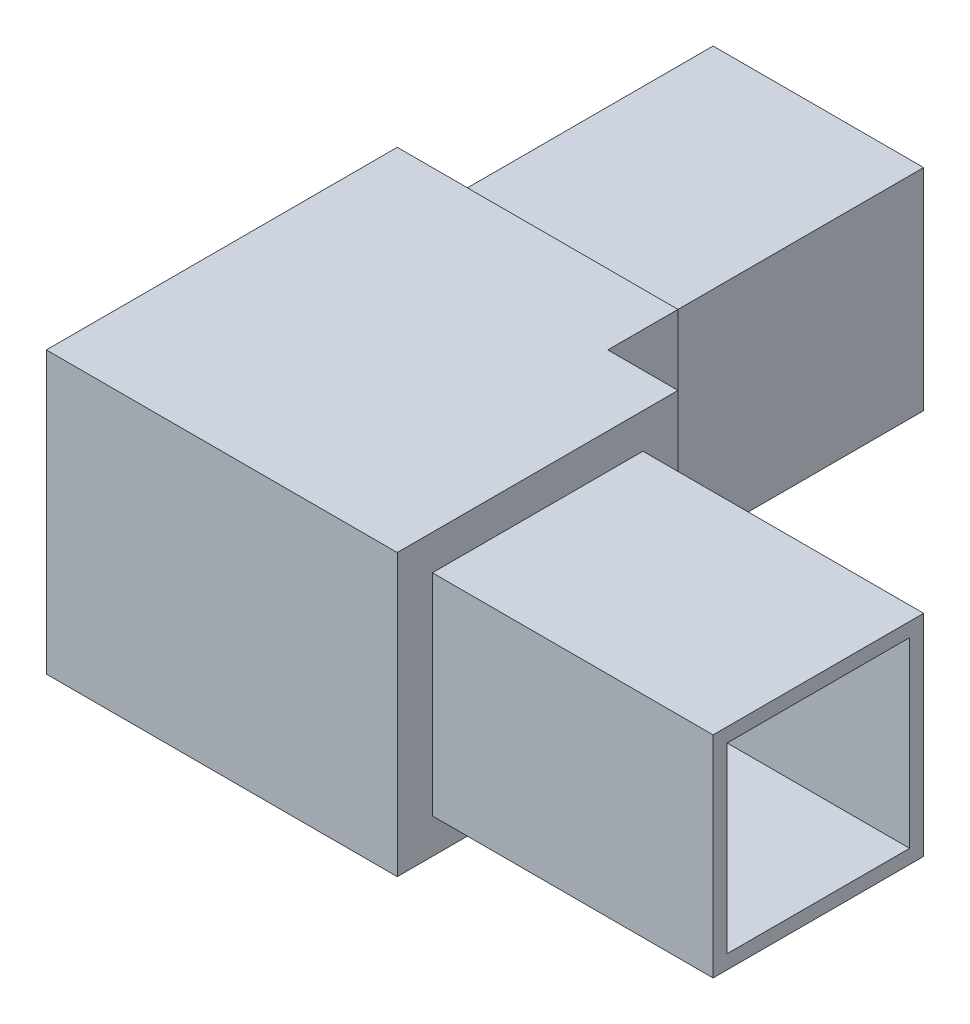
from build123d import *

# Parameters (mm, degrees)
CROQUIS1_W            = 40
CROQUIS1_H            = 50
CROQUIS1_H_2          = 40
CROQUIS1_W_2          = 50
EXTRUIR1_DEPTH        = 40
CROQUIS2_W            = 40
CROQUIS2_H            = 40
CROQUIS2_W_2          = 30
CROQUIS2_H_2          = 30
EXTRUIR2_DEPTH        = 40
CROQUIS3_W            = 40
CROQUIS3_H            = 40
CROQUIS3_W_2          = 30
CROQUIS3_H_2          = 30
EXTRUIR3_DEPTH        = 40
VACIADO1_T            = -2
CROQUIS4_R            = 10
CORTAR_EXTRUIR1_DEPTH = 10


with BuildPart() as part:
    # Croquis1 → Extruir1 (new body)
    with BuildSketch(Plane(origin=(0, 0, 0), x_dir=(1, 0, 0), z_dir=(0, 1, 0))):
        with Locations((0, 45)):
            Rectangle(CROQUIS1_W, CROQUIS1_H)
        Rectangle(CROQUIS1_W, CROQUIS1_H_2)
        with Locations((45, 0)):
            Rectangle(CROQUIS1_W_2, CROQUIS1_H_2)
    extrude(amount=EXTRUIR1_DEPTH)

    # Croquis2 → Extruir2 (cut)
    with BuildSketch(Plane(origin=(70, 0, 0), x_dir=(0, 0, -1), z_dir=(1, 0, 0))):
        with Locations((0, 20)):
            Rectangle(CROQUIS2_W, CROQUIS2_H)
        with Locations((0, 20)):
            Rectangle(CROQUIS2_W_2, CROQUIS2_H_2, mode=Mode.SUBTRACT)
    extrude(amount=-EXTRUIR2_DEPTH, mode=Mode.SUBTRACT)

    # Croquis3 → Extruir3 (cut)
    with BuildSketch(Plane(origin=(0, 0, -70), x_dir=(-1, 0, 0), z_dir=(0, 0, -1))):
        with Locations((0, 20)):
            Rectangle(CROQUIS3_W, CROQUIS3_H)
        with Locations((0, 20)):
            Rectangle(CROQUIS3_W_2, CROQUIS3_H_2, mode=Mode.SUBTRACT)
    extrude(amount=-EXTRUIR3_DEPTH, mode=Mode.SUBTRACT)

    # Vaciado1
    vaciado1_openings = [part.faces().sort_by_distance(p)[0] for p in [
        (70, 20, 0),
        (0, 20, -70),
    ]]
    offset(amount=VACIADO1_T, openings=vaciado1_openings, kind=Kind.INTERSECTION)

    # Croquis4 → Cortar-Extruir1 (cut)
    with BuildSketch(Plane.ZY.offset(20)):
        with Locations((0, 20)):
            Circle(CROQUIS4_R)
    extrude(amount=-CORTAR_EXTRUIR1_DEPTH, mode=Mode.SUBTRACT)


solid = part.part
